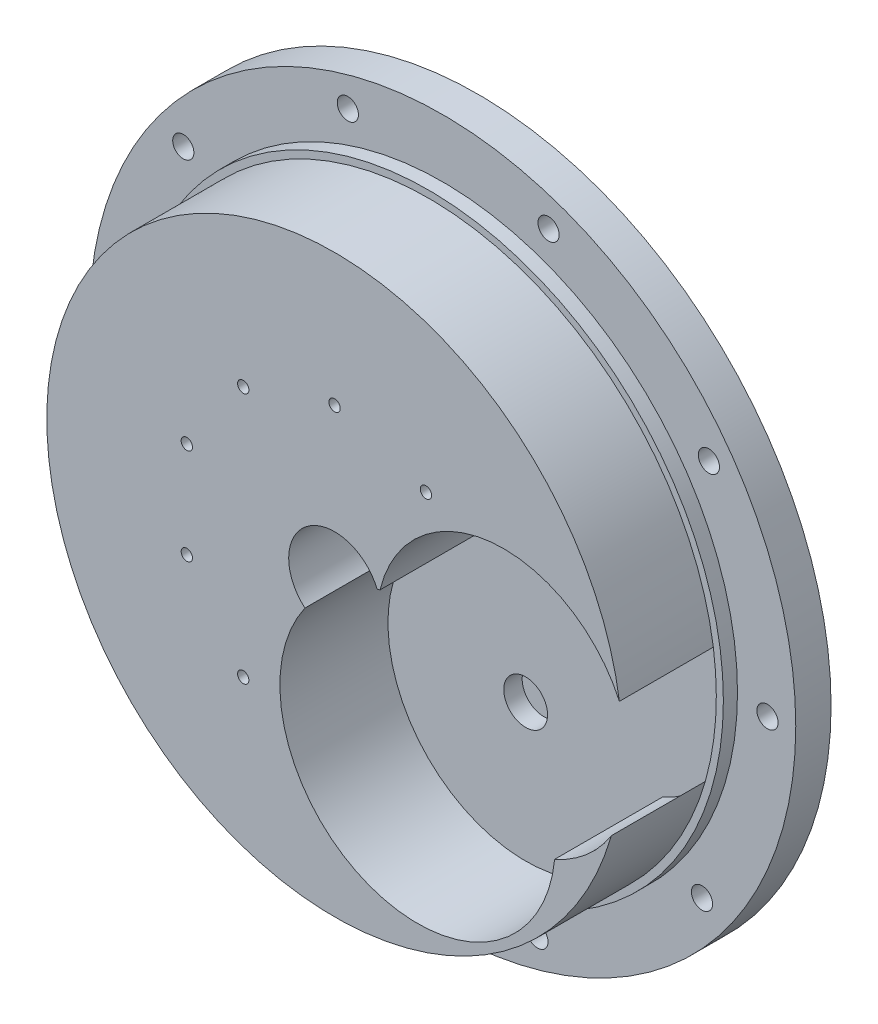
from build123d import *

# Parameters (mm, degrees)
SKETCH_1_R               = 50
EXTRUDE_1_DEPTH          = 5
EXTRUDE_START            = 5
SKETCH_1_10_R            = 41.75
SKETCH_1_10_R_2          = 40.75
EXTRUDE_2_DEPTH          = 2
SKETCH_1_8_R             = 1.5
CUT_EXTRUDE_1_DEPTH      = 72.056315694
SKETCH_1_9_R             = 2.25
CUT_EXTRUDE_2_DEPTH      = 2
PATTERN_CIRCULAR_1_COUNT = 10
EXTRUDE_3_DEPTH          = 15.3
SKETCH_3_R               = 0.8
CUT_EXTRUDE_3_DEPTH      = 4
PATTERN_CIRCULAR_2_COUNT = 10
SKETCH_4_R               = 3.1
CUT_EXTRUDE_4_DEPTH      = 2.6


with BuildPart() as part:
    # 草图1 → 凸台-拉伸1 (new body)
    with BuildSketch(Plane.XY):
        Circle(SKETCH_1_R)
    extrude(amount=EXTRUDE_1_DEPTH)

    # 草图1<10> → 凸台-拉伸2 (add)
    with BuildSketch(Plane.XY.offset(EXTRUDE_START)):
        Circle(SKETCH_1_10_R)
        Circle(SKETCH_1_10_R_2, mode=Mode.SUBTRACT)
    extrude(amount=EXTRUDE_2_DEPTH)

    # 草图1<8> → 切除-拉伸1 (cut, through all)
    with BuildSketch(Plane.XY):
        with Locations((-13.425009626, 43.997376246)):
            Circle(SKETCH_1_8_R)
    cut_extrude_1 = extrude(amount=CUT_EXTRUDE_1_DEPTH, mode=Mode.SUBTRACT)

    # 草图1<9> → 切除-拉伸2 (cut)
    with BuildSketch(Plane.XY):
        with Locations((-13.425009626, 43.997376246)):
            Circle(SKETCH_1_9_R)
    cut_extrude_2 = extrude(amount=CUT_EXTRUDE_2_DEPTH, mode=Mode.SUBTRACT)

    # 阵列(圆周)1: 切除-拉伸1, 切除-拉伸2 ×10 about axis
    pattern_circular_1_axis = Axis((0, 0, 0), (0, 0, 1))
    add([cut_extrude_1.rotate(pattern_circular_1_axis, i * 360 / PATTERN_CIRCULAR_1_COUNT) for i in range(1, PATTERN_CIRCULAR_1_COUNT)], mode=Mode.SUBTRACT)
    add([cut_extrude_2.rotate(pattern_circular_1_axis, i * 360 / PATTERN_CIRCULAR_1_COUNT) for i in range(1, PATTERN_CIRCULAR_1_COUNT)], mode=Mode.SUBTRACT)

    # 草图2 → 凸台-拉伸3 (add)
    with BuildSketch(Plane(origin=(0, 0, 5), x_dir=(-1, 0, 0), z_dir=(0, 0, -1))):
        with BuildLine():
            ThreePointArc((-6.017976905, 2.456410789), (3.82060414, 5.258610463), (4.195842623, -4.964363472))
            ThreePointArc((4.195842623, -4.964363472), (-4.96592188, -34.460078522), (-31.161250412, -18.09731903))
            ThreePointArc((-31.161250412, -18.09731903), (-35.692076103, -15.246050057), (-39.183964293, -11.188361914))
            ThreePointArc((-39.183964293, -11.188361914), (40.658588797, 2.72794007), (-40.327377462, 5.8536422))
            ThreePointArc((-40.327377462, 5.8536422), (-22.215964652, 16.310012331), (-6.440100033, 2.581172401))
            ThreePointArc((-6.440100033, 2.581172401), (-6.228686427, 2.519982708), (-6.017976905, 2.456410789))
        make_face()
    extrude(amount=-EXTRUDE_3_DEPTH)

    # 草图3 → 切除-拉伸3 (cut)
    with BuildSketch(Plane.XY.offset(20.3)):
        with Locations((0, 22)):
            Circle(SKETCH_3_R)
    cut_extrude_3 = extrude(amount=-CUT_EXTRUDE_3_DEPTH, mode=Mode.SUBTRACT)

    # 阵列(圆周)2: 切除-拉伸3 ×10 about axis
    pattern_circular_2_axis = Axis((0, 0, 0), (0, 0, 1))
    for i in range(1, PATTERN_CIRCULAR_2_COUNT):
        add(cut_extrude_3.rotate(pattern_circular_2_axis, i * 360 / PATTERN_CIRCULAR_2_COUNT), mode=Mode.SUBTRACT)

    # 草图4 → 切除-拉伸4 (cut)
    with BuildSketch(Plane.XY.offset(5)):
        with Locations((11.755705046, -16.180339888)):
            Circle(SKETCH_4_R)
    extrude(amount=-CUT_EXTRUDE_4_DEPTH, mode=Mode.SUBTRACT)


solid = part.part
